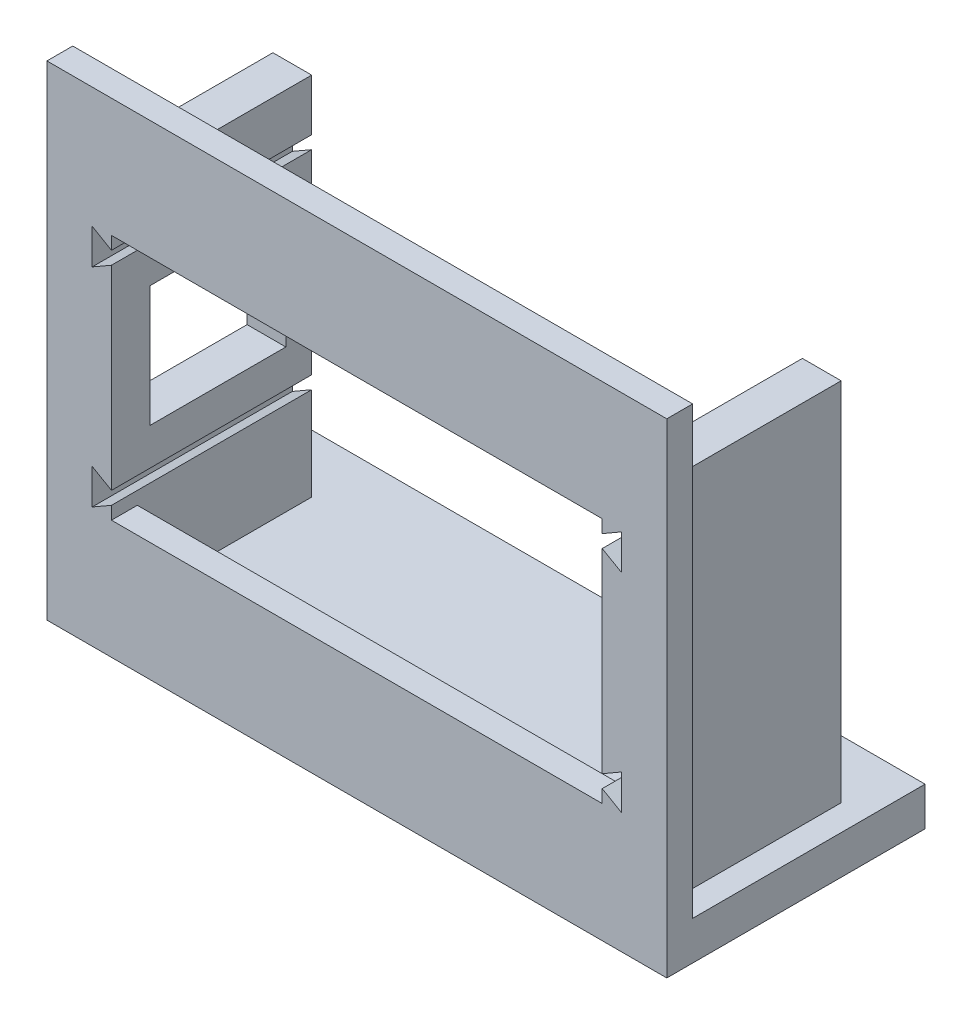
from build123d import *

# Parameters (mm, degrees)
SKETCH2_W                = 200
SKETCH2_H                = 150
BOSS_EXTRUDE1_DEPTH      = 80
FILLET1_R                = 10
SHELL1_T                 = -2
SHELL1_THICKNESS_2_DEPTH = 13
SKETCH5_W                = 36.5
SKETCH5_H                = 27.5
CUT_EXTRUDE1_DEPTH       = 2
BOSS_EXTRUDE2_DEPTH      = 16
SKETCH7_W                = 36.5
SKETCH7_H                = 27.5
CUT_EXTRUDE2_DEPTH       = 2
BOSS_EXTRUDE3_DEPTH      = 16
SKETCH10_W               = 36.5
SKETCH10_H               = 27.5
CUT_EXTRUDE4_DEPTH       = 2
BOSS_EXTRUDE4_DEPTH      = 16
SKETCH13_W               = 38
SKETCH13_H               = 19.1
CUT_EXTRUDE5_DEPTH       = 2
BOSS_EXTRUDE5_DEPTH      = 13.5
SKETCH15_W               = 10.5
SKETCH15_H               = 9.367949192
CUT_EXTRUDE6_DEPTH       = 3
CUT_EXTRUDE8_REACH       = 150.408
SKETCH20_R               = 8
SPLIT1_SURFACE_1_BACK    = 263.488
SPLIT1_SURFACE_1_DEPTH   = 526.976
SPLIT1_SURFACE_2_BACK    = 263.488
SPLIT1_SURFACE_2_DEPTH   = 526.976
SPLIT2_SURFACE_3_BACK    = 263.488
SPLIT2_SURFACE_3_DEPTH   = 526.976
SPLIT2_SURFACE_4_BACK    = 263.488
SPLIT2_SURFACE_4_DEPTH   = 526.976


with BuildPart() as part:
    # Sketch2 → Boss-Extrude1 (new body)
    with BuildSketch(Plane(origin=(0, 0, 0), x_dir=(1, 0, 0), z_dir=(0, 1, 0))):
        Rectangle(SKETCH2_W, SKETCH2_H)
    extrude(amount=BOSS_EXTRUDE1_DEPTH)

    # Fillet1
    fillet1_edges = [part.edges().sort_by_distance(p)[0] for p in [
        (100, 40, 75),
        (-100, 40, 75),
        (-100, 40, -75),
        (100, 40, -75),
    ]]
    fillet(fillet1_edges, radius=FILLET1_R)

    # Shell1
    shell1_openings = [part.faces().sort_by_distance(p)[0] for p in [
        (0, 80, 0),
    ]]
    offset(amount=SHELL1_T, openings=shell1_openings, kind=Kind.INTERSECTION)

    # Shell1 thickness 2 face (on inner face of the shell) → Shell1 thickness 2 (add)
    with BuildSketch(Plane(origin=(0, 2, 0), x_dir=(0, 0, -1), z_dir=(0, -1, 0))):
        with BuildLine():
            ThreePointArc((73, -90), (70.656854249, -95.656854249), (65, -98))
            Line((65, -98), (-65, -98))
            ThreePointArc((-65, -98), (-70.656854249, -95.656854249), (-73, -90))
            Line((-73, -90), (-73, 90))
            ThreePointArc((-73, 90), (-70.656854249, 95.656854249), (-65, 98))
            Line((-65, 98), (65, 98))
            ThreePointArc((65, 98), (70.656854249, 95.656854249), (73, 90))
            Line((73, 90), (73, -90))
        make_face()
    extrude(amount=-SHELL1_THICKNESS_2_DEPTH)

    # Sketch5 → Cut-Extrude1 (cut)
    with BuildSketch(Plane.XY.offset(75)):
        with Locations((0, 30.75)):
            Rectangle(SKETCH5_W, SKETCH5_H)
        Polygon((-18.25, 43.5), (-19.75, 44.366025404), (-19.75, 41.633974596), (-18.25, 42.5), align=None)
        Polygon((-19.75, 19.866025404), (-18.25, 19), (-18.25, 18), (-19.75, 17.133974596), align=None)
        Polygon((19.75, 17.133974596), (19.75, 19.866025404), (18.25, 19), (18.25, 18), align=None)
        Polygon((19.75, 41.633974596), (18.25, 42.5), (18.25, 43.5), (19.75, 44.366025404), align=None)
    extrude(amount=-CUT_EXTRUDE1_DEPTH, mode=Mode.SUBTRACT)

    # Sketch6 → Boss-Extrude2 (add)
    with BuildSketch(Plane(origin=(0, 0, 73), x_dir=(-1, 0, 0), z_dir=(0, 0, -1))):
        Polygon((18.25, 15), (21.25, 15), (21.25, 47.5), (18.25, 47.5), (18.25, 43.5), (19.75, 44.366025404), (19.75, 41.633974596), (18.25, 42.5), (18.25, 19), (19.75, 19.866025404), (19.75, 17.133974596), (18.25, 18), align=None)
        Polygon((-21.25, 47.5), (-21.25, 15), (-18.25, 15), (-18.25, 18), (-19.75, 17.133974596), (-19.75, 19.866025404), (-18.25, 19), (-18.25, 42.5), (-19.75, 41.633974596), (-19.75, 44.366025404), (-18.25, 43.5), (-18.25, 47.5), align=None)
    extrude(amount=BOSS_EXTRUDE2_DEPTH)

    # Sketch7 → Cut-Extrude2 (cut)
    with BuildSketch(Plane(origin=(100, 0, 0), x_dir=(0, 0, -1), z_dir=(1, 0, 0))):
        with Locations((0, 30.75)):
            Rectangle(SKETCH7_W, SKETCH7_H)
        Polygon((-18.25, 43.5), (-19.75, 44.366025404), (-19.75, 41.633974596), (-18.25, 42.5), align=None)
        Polygon((-19.75, 19.866025404), (-18.25, 19), (-18.25, 18), (-19.75, 17.133974596), align=None)
        Polygon((19.75, 17.133974596), (19.75, 19.866025404), (18.25, 19), (18.25, 18), align=None)
        Polygon((19.75, 41.633974596), (18.25, 42.5), (18.25, 43.5), (19.75, 44.366025404), align=None)
    extrude(amount=-CUT_EXTRUDE2_DEPTH, mode=Mode.SUBTRACT)

    # Sketch8 → Boss-Extrude3 (add)
    with BuildSketch(Plane.ZY.offset(-98)):
        Polygon((-21.25, 47.5), (-18.25, 47.5), (-18.25, 43.5), (-19.75, 44.366025404), (-19.75, 41.633974596), (-18.25, 42.5), (-18.25, 19), (-19.75, 19.866025404), (-19.75, 17.133974596), (-18.25, 18), (-18.25, 15), (-21.25, 15), align=None)
        Polygon((19.75, 44.366025404), (18.25, 43.5), (18.25, 47.5), (21.25, 47.5), (21.25, 15), (18.25, 15), (18.25, 18), (19.75, 17.133974596), (19.75, 19.866025404), (18.25, 19), (18.25, 42.5), (19.75, 41.633974596), align=None)
    extrude(amount=BOSS_EXTRUDE3_DEPTH)

    # Sketch10 → Cut-Extrude4 (cut)
    with BuildSketch(Plane.ZY.offset(100)):
        with Locations((0, 30.75)):
            Rectangle(SKETCH10_W, SKETCH10_H)
        Polygon((-18.25, 43.5), (-19.75, 44.366025404), (-19.75, 41.633974596), (-18.25, 42.5), align=None)
        Polygon((-19.75, 19.866025404), (-18.25, 19), (-18.25, 18), (-19.75, 17.133974596), align=None)
        Polygon((19.75, 17.133974596), (19.75, 19.866025404), (18.25, 19), (18.25, 18), align=None)
        Polygon((19.75, 41.633974596), (18.25, 42.5), (18.25, 43.5), (19.75, 44.366025404), align=None)
    extrude(amount=-CUT_EXTRUDE4_DEPTH, mode=Mode.SUBTRACT)

    # Sketch11 → Boss-Extrude4 (add)
    with BuildSketch(Plane(origin=(-98, 0, 0), x_dir=(0, 0, -1), z_dir=(1, 0, 0))):
        Polygon((-18.25, 47.5), (-21.25, 47.5), (-21.25, 15), (-18.25, 15), (-18.25, 18), (-19.75, 17.133974596), (-19.75, 19.866025404), (-18.25, 19), (-18.25, 42.5), (-19.75, 41.633974596), (-19.75, 44.366025404), (-18.25, 43.5), align=None)
        Polygon((19.75, 44.366025404), (18.25, 43.5), (18.25, 47.5), (21.25, 47.5), (21.25, 15), (18.25, 15), (18.25, 18), (19.75, 17.133974596), (19.75, 19.866025404), (18.25, 19), (18.25, 42.5), (19.75, 41.633974596), align=None)
    extrude(amount=BOSS_EXTRUDE4_DEPTH)

    # Sketch13 → Cut-Extrude5 (cut)
    with BuildSketch(Plane.XY.offset(75)):
        Polygon((41, 39.3), (39.5, 40.166025404), (39.5, 37.433974596), (41, 38.3), align=None)
        with Locations((60, 30.75)):
            Rectangle(SKETCH13_W, SKETCH13_H)
        Polygon((41, 22.2), (39.5, 21.333974596), (39.5, 24.066025404), (41, 23.2), align=None)
        Polygon((79, 22.2), (79, 23.2), (80.5, 24.066025404), (80.5, 21.333974596), align=None)
        Polygon((79, 39.3), (80.5, 40.166025404), (80.5, 37.433974596), (79, 38.3), align=None)
    extrude(amount=-CUT_EXTRUDE5_DEPTH, mode=Mode.SUBTRACT)

    # Sketch14 → Boss-Extrude5 (add)
    with BuildSketch(Plane(origin=(0, 0, 73), x_dir=(-1, 0, 0), z_dir=(0, 0, -1))):
        Polygon((-79, 43.3), (-82, 43.3), (-82, 15), (-79, 15), (-79, 22.2), (-80.5, 21.333974596), (-80.5, 24.066025404), (-79, 23.2), (-79, 38.3), (-80.5, 37.433974596), (-80.5, 40.166025404), (-79, 39.3), align=None)
        Polygon((-39.5, 40.166025404), (-41, 39.3), (-41, 43.3), (-38, 43.3), (-38, 15), (-41, 15), (-41, 22.2), (-39.5, 21.333974596), (-39.5, 24.066025404), (-41, 23.2), (-41, 38.3), (-39.5, 37.433974596), align=None)
    extrude(amount=BOSS_EXTRUDE5_DEPTH)

    # Sketch15 → Cut-Extrude6 (cut)
    with BuildSketch(Plane.ZY.offset(-38)):
        with Locations((66.75, 30.75)):
            Rectangle(SKETCH15_W, SKETCH15_H)
    extrude(amount=-CUT_EXTRUDE6_DEPTH, mode=Mode.SUBTRACT)

    # Sketch18 → Cut-Revolve1 (revolve, cut)
    with BuildSketch(Plane(origin=(0, 0, 0), x_dir=(0, 0, -1), z_dir=(1, 0, 0)), mode=Mode.PRIVATE) as cut_revolve1_sk:
        Polygon((-42.5, 0), (-70, 0), (-47.5, 10), (-42.5, 10), align=None)
    revolve(cut_revolve1_sk.sketch.rotate(Axis((0, 0, 0), (0, 1, 0)), 180), axis=Axis((0, 0, 0), (0, 1, 0)), mode=Mode.SUBTRACT)

    # Cut-Extrude8: up to this face of the body (flat: up to its plane)
    cut_extrude8_end = Plane(part.part.faces().sort_by_distance((-0.172388952, 15, -0.411685035))[0])
    # Sketch20 → Cut-Extrude8 (cut, up to the picked face)
    with BuildSketch(Plane.XZ, mode=Mode.PRIVATE) as cut_extrude8_sk1:
        with Locations(Location((0, -42.5, 0), (0, 0, 270))):
            Circle(SKETCH20_R)
    cut_extrude8_tool1 = split(extrude(cut_extrude8_sk1.sketch, amount=-CUT_EXTRUDE8_REACH, mode=Mode.PRIVATE), bisect_by=cut_extrude8_end, keep=Keep.BOTH, mode=Mode.PRIVATE)
    add(cut_extrude8_tool1.solids().sort_by(Axis((0, 0, -42.5), (0, 1, 0)))[0], mode=Mode.SUBTRACT)


with BuildPart() as body_2:
    # Split1: the piece behind the surface
    add(part.part)
    # Split1 surface: a surface, the sketch's curves swept straight by 526.976 mm
    with BuildLine(Plane.XY.offset(75).offset(-SPLIT1_SURFACE_1_BACK), mode=Mode.PRIVATE) as split1_surface_1_path:
        Line((36, 49.5), (84, 49.5))
        Line((84, 49.5), (84, 12))
        Line((84, 12), (36, 12))
        Line((36, 12), (36, 49.5))
    split1_surface_1 = Shell.extrude(split1_surface_1_path.wire(), (0 * SPLIT1_SURFACE_1_DEPTH, 0 * SPLIT1_SURFACE_1_DEPTH, 1 * SPLIT1_SURFACE_1_DEPTH))
    split(bisect_by=split1_surface_1, keep=Keep.BOTTOM)


with BuildPart() as part_1:
    add(part.part)

    # Split1: split by a surface, the side it looks to stays
    # Split1 surface: a surface, the sketch's curves swept straight by 526.976 mm
    with BuildLine(Plane.XY.offset(75).offset(-SPLIT1_SURFACE_2_BACK), mode=Mode.PRIVATE) as split1_surface_2_path:
        Line((36, 49.5), (84, 49.5))
        Line((84, 49.5), (84, 12))
        Line((84, 12), (36, 12))
        Line((36, 12), (36, 49.5))
    split1_surface_2 = Shell.extrude(split1_surface_2_path.wire(), (0 * SPLIT1_SURFACE_2_DEPTH, 0 * SPLIT1_SURFACE_2_DEPTH, 1 * SPLIT1_SURFACE_2_DEPTH))
    split(bisect_by=split1_surface_2, keep=Keep.TOP)


with BuildPart() as body_3:
    # Split2: the piece behind the surface
    add(body_2.part)
    # Split2 surface: a surface, the sketch's curves swept straight by 526.976 mm
    with BuildLine(Plane(origin=(0, 15, 0), x_dir=(1, 0, 0), z_dir=(0, 1, 0)).offset(-SPLIT2_SURFACE_3_BACK), mode=Mode.PRIVATE) as split2_surface_3_path:
        Line((36, -75), (84, -75))
        Line((84, -75), (84, -55))
        Line((84, -55), (36, -55))
        Line((36, -55), (36, -75))
    split2_surface_3 = Shell.extrude(split2_surface_3_path.wire(), (0 * SPLIT2_SURFACE_3_DEPTH, 1 * SPLIT2_SURFACE_3_DEPTH, 0 * SPLIT2_SURFACE_3_DEPTH))
    split(bisect_by=split2_surface_3, keep=Keep.BOTTOM)


with BuildPart() as body_2_1:
    add(body_2.part)

    # Split2: split by a surface, the side it looks to stays
    # Split2 surface: a surface, the sketch's curves swept straight by 526.976 mm
    with BuildLine(Plane(origin=(0, 15, 0), x_dir=(1, 0, 0), z_dir=(0, 1, 0)).offset(-SPLIT2_SURFACE_4_BACK), mode=Mode.PRIVATE) as split2_surface_4_path:
        Line((36, -75), (84, -75))
        Line((84, -75), (84, -55))
        Line((84, -55), (36, -55))
        Line((36, -55), (36, -75))
    split2_surface_4 = Shell.extrude(split2_surface_4_path.wire(), (0 * SPLIT2_SURFACE_4_DEPTH, 1 * SPLIT2_SURFACE_4_DEPTH, 0 * SPLIT2_SURFACE_4_DEPTH))
    split(bisect_by=split2_surface_4, keep=Keep.TOP)


solid = body_2_1.part
